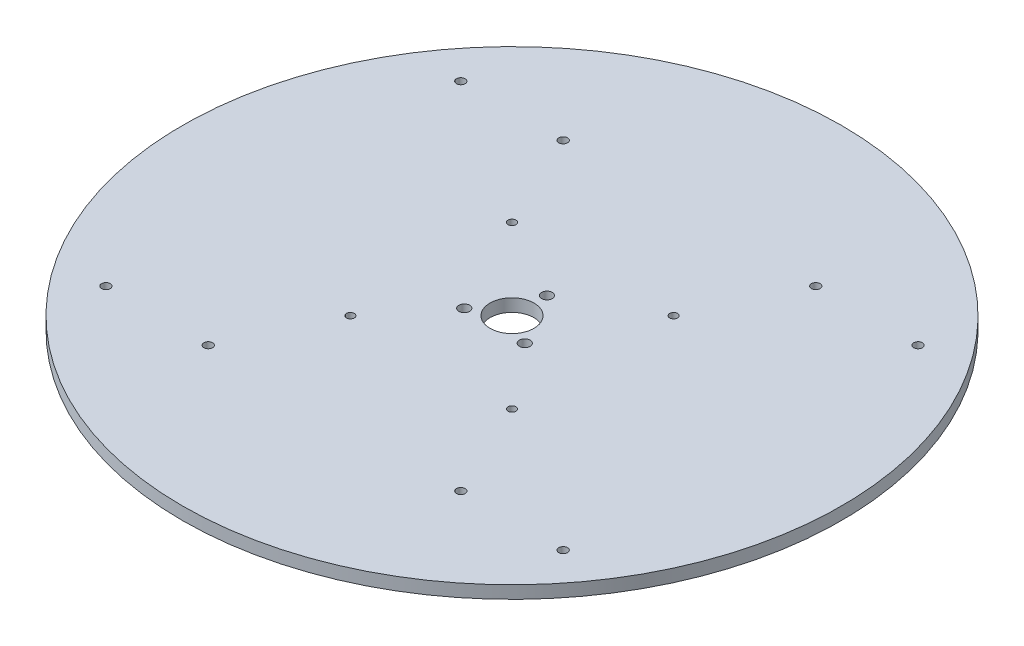
from build123d import *

# Parameters (mm, degrees)
SKETCH1_R           = 165.1
BOSS_EXTRUDE1_DEPTH = 6.35
SKETCH2_R           = 11
SKETCH2_R_2         = 1.984375
SKETCH2_R_3         = 2.7
CUT_EXTRUDE1_DEPTH  = 234.572991803
SKETCH3_R           = 2.1828125
CUT_EXTRUDE2_DEPTH  = 234.572991803


with BuildPart() as part:
    # Sketch1 → Boss-Extrude1 (new body)
    with BuildSketch(Plane(origin=(0, 0, 0), x_dir=(1, 0, 0), z_dir=(0, 1, 0))):
        with Locations(Location((0, 0, 0), (0, 0, 270))):
            Circle(SKETCH1_R)
    extrude(amount=BOSS_EXTRUDE1_DEPTH)

    # Sketch2 → Cut-Extrude1 (cut, through all)
    with BuildSketch(Plane(origin=(0, 6.35, 0), x_dir=(1, 0, 0), z_dir=(0, 1, 0))):
        with Locations(Location((0, 0, 0), (0, 0, 270))):
            Circle(SKETCH2_R)
        with Locations(Location((-40.4876, 40.4876, 0), (0, 0, 270))):
            Circle(SKETCH2_R_2)
        with Locations(Location((-40.4876, -40.4876, 0), (0, 0, 270))):
            Circle(SKETCH2_R_2)
        with Locations(Location((40.4876, -40.4876, 0), (0, 0, 270))):
            Circle(SKETCH2_R_2)
        with Locations(Location((40.4876, 40.4876, 0), (0, 0, 270))):
            Circle(SKETCH2_R_2)
        with Locations(Location((0, 17.5, 0), (0, 0, 270))):
            Circle(SKETCH2_R_3)
        with Locations(Location((-15.155444566, -8.75, 0), (0, 0, 270))):
            Circle(SKETCH2_R_3)
        with Locations(Location((15.155444566, -8.75, 0), (0, 0, 270))):
            Circle(SKETCH2_R_3)
    extrude(amount=-CUT_EXTRUDE1_DEPTH, mode=Mode.SUBTRACT)

    # Sketch3 → Cut-Extrude2 (cut, through all)
    with BuildSketch(Plane(origin=(0, 6.35, 0), x_dir=(1, 0, 0), z_dir=(0, 1, 0))):
        with Locations(Location((-114.5413, 88.9, 0), (0, 0, 270))):
            Circle(SKETCH3_R)
        with Locations(Location((-63.2587, 88.9, 0), (0, 0, 270))):
            Circle(SKETCH3_R)
        with Locations(Location((63.2587, 88.9, 0), (0, 0, 270))):
            Circle(SKETCH3_R)
        with Locations(Location((114.5413, 88.9, 0), (0, 0, 270))):
            Circle(SKETCH3_R)
        with Locations(Location((114.5413, -88.9, 0), (0, 0, 270))):
            Circle(SKETCH3_R)
        with Locations(Location((63.2587, -88.9, 0), (0, 0, 270))):
            Circle(SKETCH3_R)
        with Locations(Location((-63.2587, -88.9, 0), (0, 0, 270))):
            Circle(SKETCH3_R)
        with Locations(Location((-114.5413, -88.9, 0), (0, 0, 270))):
            Circle(SKETCH3_R)
    extrude(amount=-CUT_EXTRUDE2_DEPTH, mode=Mode.SUBTRACT)


solid = part.part
